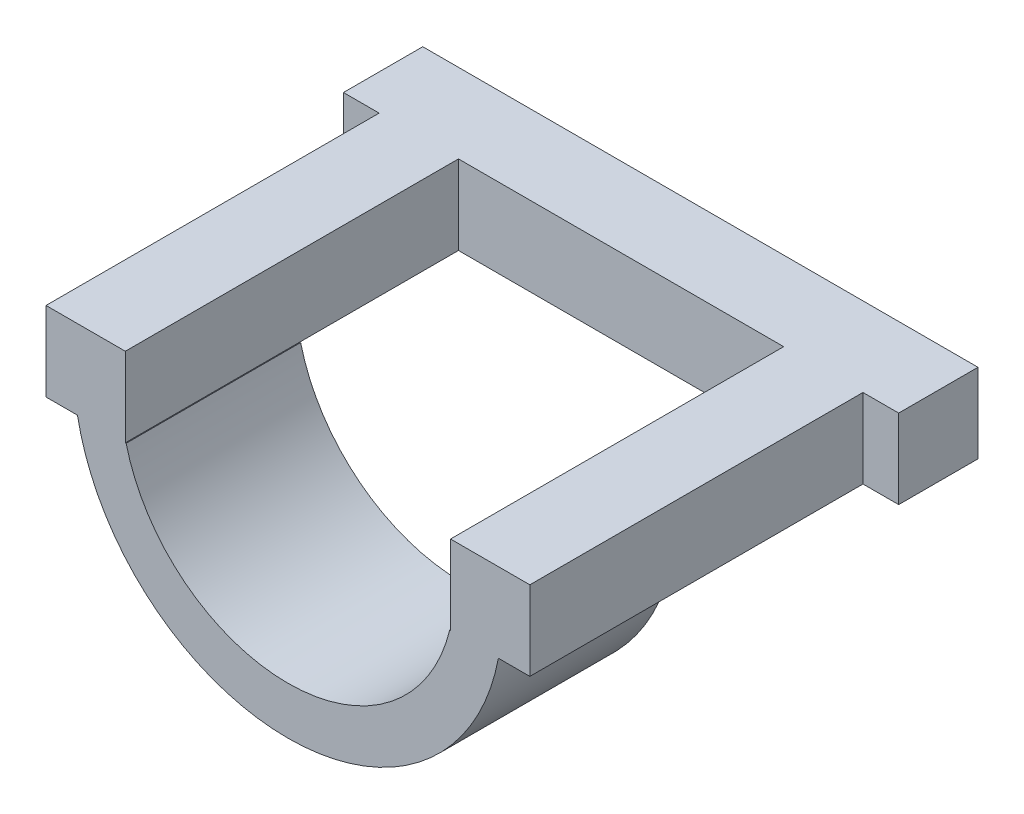
from build123d import *

# Parameters (mm, degrees)
SKETCH_1_W      = 70
SKETCH_1_H      = 10
EXTRUDE_1_DEPTH = 10
SKETCH_2_W      = 10
SKETCH_2_H      = 10
EXTRUDE_2_DEPTH = 42
EXTRUDE_3_DEPTH = 22


with BuildPart() as part:
    # 草图1 → 凸台-拉伸1 (new body)
    with BuildSketch(Plane(origin=(0, 0, 0), x_dir=(1, 0, 0), z_dir=(0, 1, 0))):
        with Locations((35, 5)):
            Rectangle(SKETCH_1_W, SKETCH_1_H)
    extrude(amount=EXTRUDE_1_DEPTH)

    # 草图2 → 凸台-拉伸2 (add)
    with BuildSketch(Plane.XY):
        with Locations((9.5, 5)):
            Rectangle(SKETCH_2_W, SKETCH_2_H)
        with Locations((60.5, 5)):
            Rectangle(SKETCH_2_W, SKETCH_2_H)
    extrude(amount=EXTRUDE_2_DEPTH)

    # 草图3 → 凸台-拉伸3 (add)
    with BuildSketch(Plane.XY.offset(42)):
        with BuildLine():
            Line((8.467001677, 0), (14.603921946, 0))
            ThreePointArc((14.603921946, 0), (35, -16), (55.396078054, 0))
            Line((55.396078054, 0), (61.532998323, 0))
            ThreePointArc((61.532998323, 0), (35, -22), (8.467001677, 0))
        make_face()
    extrude(amount=-EXTRUDE_3_DEPTH)


solid = part.part
